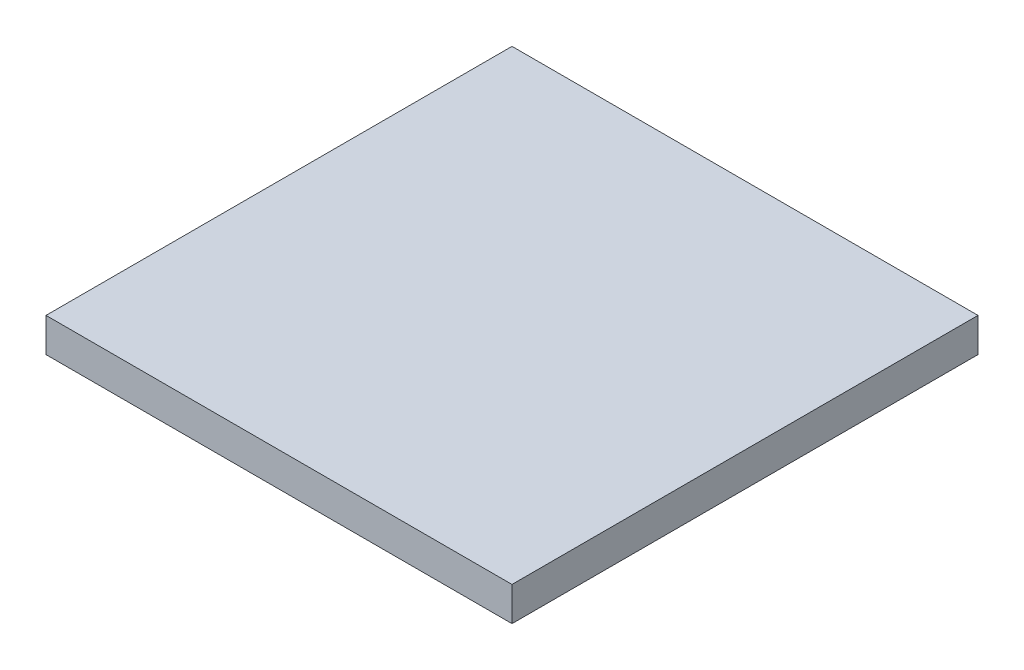
from build123d import *

# Parameters (mm, degrees)
SKETCH3_W           = 152.4
SKETCH3_H           = 11.1125
BOSS_EXTRUDE1_DEPTH = 76.2


with BuildPart() as part:
    # Sketch3 → Boss-Extrude1 (new, symmetric)
    with BuildSketch(Plane.XY):
        Rectangle(SKETCH3_W, SKETCH3_H)
    extrude(amount=BOSS_EXTRUDE1_DEPTH, both=True)


solid = part.part
